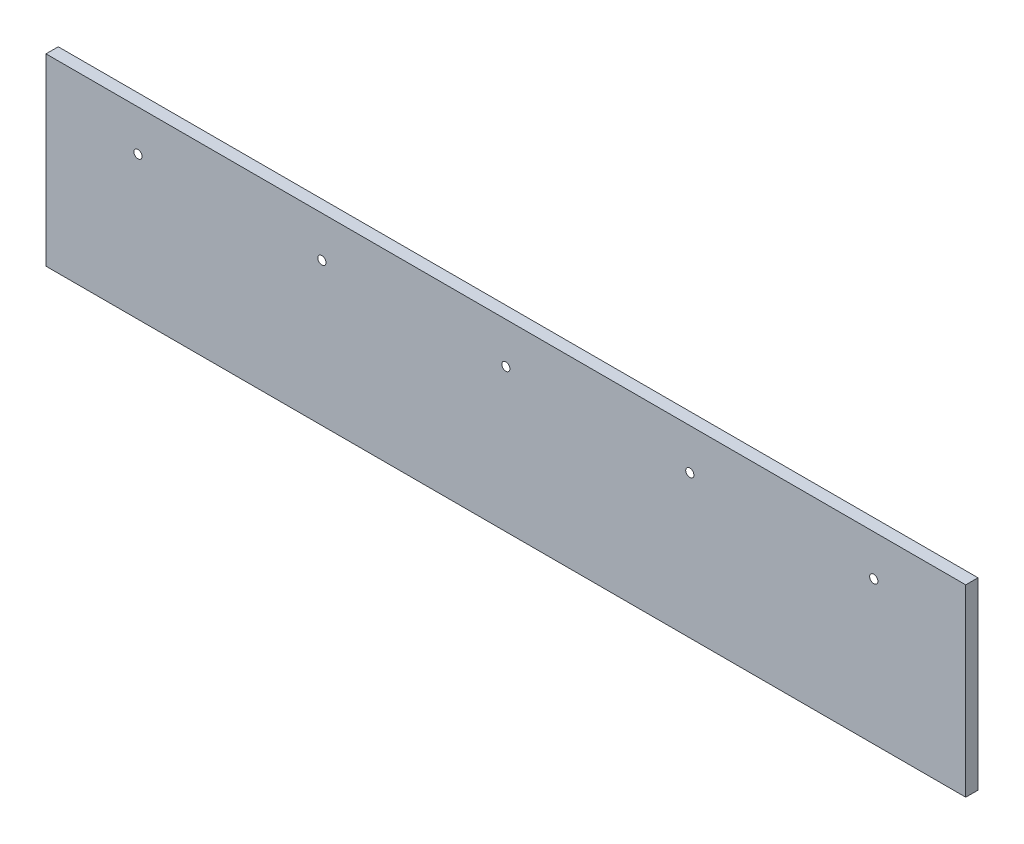
from build123d import *

# Parameters (mm, degrees)
SKETCH1_R           = 1
BOSS_EXTRUDE1_DEPTH = 3
DRAFT3_ANGLE        = -60


with BuildPart() as part:
    # Sketch1 → Boss-Extrude1 (new body)
    with BuildSketch(Plane.XY):
        Polygon((-112.5, 7.5), (-112.5, -22.5), (112.5, -22.5), (112.5, 7.5), (112.5, 22.5), (-112.5, 22.5), align=None)
        with Locations((-90, 12.5)):
            Circle(SKETCH1_R, mode=Mode.SUBTRACT)
        with Locations((-45, 12.5)):
            Circle(SKETCH1_R, mode=Mode.SUBTRACT)
        with Locations((0, 12.5)):
            Circle(SKETCH1_R, mode=Mode.SUBTRACT)
        with Locations((45, 12.5)):
            Circle(SKETCH1_R, mode=Mode.SUBTRACT)
        with Locations((90, 12.5)):
            Circle(SKETCH1_R, mode=Mode.SUBTRACT)
    extrude(amount=BOSS_EXTRUDE1_DEPTH)

    # Draft3
    draft3_faces = [part.faces().sort_by_distance(p)[0] for p in [
        (89, 12.5, 1.5),
        (44, 12.5, 1.5),
        (-1, 12.5, 1.5),
        (-46, 12.5, 1.5),
        (-91, 12.5, 1.5),
    ]]
    draft(draft3_faces, Plane.XY.offset(3), DRAFT3_ANGLE)


solid = part.part
